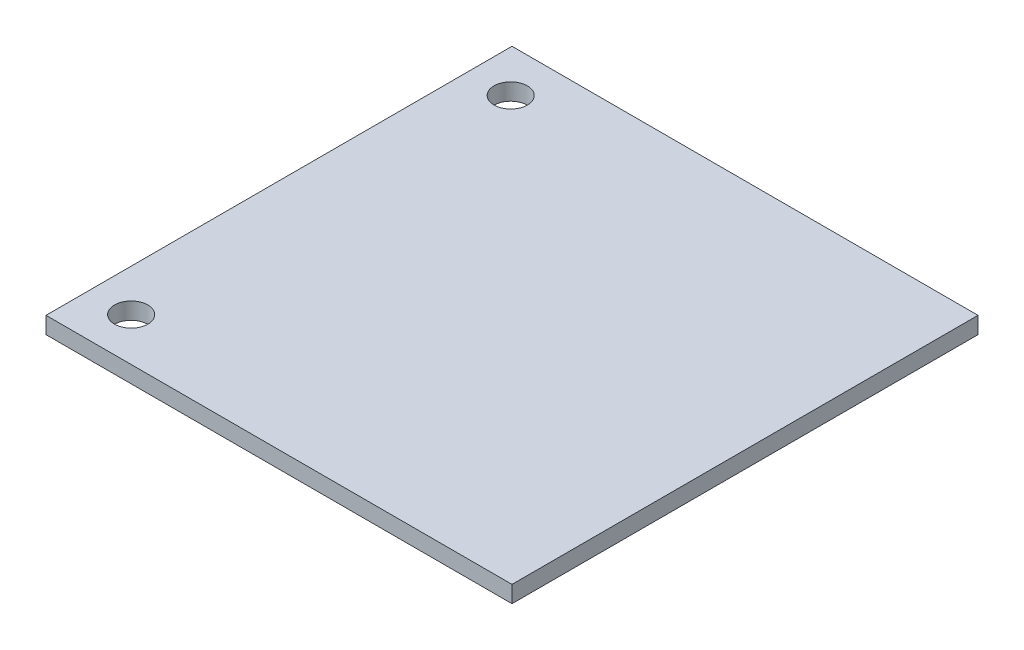
from build123d import *

# Parameters (mm, degrees)
SKETCH1_W           = 44.45
SKETCH1_H           = 44.45
SKETCH1_R           = 1.59
BOSS_EXTRUDE1_DEPTH = 1.6


with BuildPart() as part:
    # Sketch1 → Boss-Extrude1 (new body)
    with BuildSketch(Plane(origin=(0, 0, 0), x_dir=(1, 0, 0), z_dir=(0, 1, 0))):
        Rectangle(SKETCH1_W, SKETCH1_H)
        with Locations(Location((-18.225, 18.1, 0), (0, 0, 270))):
            Circle(SKETCH1_R, mode=Mode.SUBTRACT)
        with Locations(Location((-18.225, -18.1, 0), (0, 0, 270))):
            Circle(SKETCH1_R, mode=Mode.SUBTRACT)
    extrude(amount=BOSS_EXTRUDE1_DEPTH)


solid = part.part
